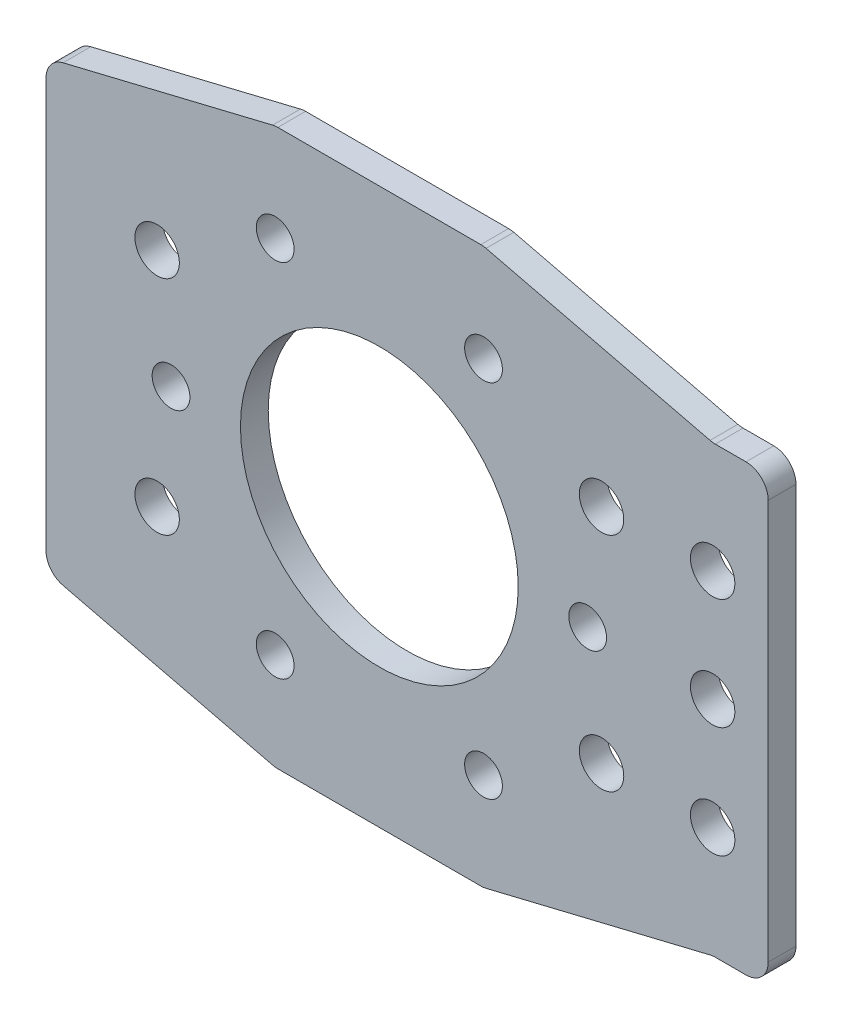
from build123d import *

# Parameters (mm, degrees)
SKETCH2_R           = 15.875
SKETCH2_R_2         = 2.159
SKETCH2_R_3         = 2.54
BOSS_EXTRUDE1_DEPTH = 3.175
FILLET1_R           = 2.54
SKETCH3_OUTSIDE_W   = 172.398
SKETCH3_OUTSIDE_H   = 96.198
SKETCH3_OUTSIDE_W_2 = 82.55
SKETCH3_OUTSIDE_H_2 = 74.066797773
CUT_EXTRUDE1_DEPTH  = 510.001122911
FILLET2_R           = 2.54


with BuildPart() as part:
    # Sketch2 → Boss-Extrude1 (new body)
    with BuildSketch(Plane.XY):
        Polygon((-508, 25.4), (-481.80625, 31.75), (-457.99375, 31.75), (-431.8, 25.4), (-368.3, 25.4), (-368.3, -25.4), (-431.8, -25.4), (-457.99375, -31.75), (-481.80625, -31.75), (-508, -25.4), align=None)
        with Locations((-469.9, 0)):
            Circle(SKETCH2_R, mode=Mode.SUBTRACT)
        with Locations((-457.99375, 20.622229928)):
            Circle(SKETCH2_R_2, mode=Mode.SUBTRACT)
        with Locations((-481.80625, 20.622229928)):
            Circle(SKETCH2_R_2, mode=Mode.SUBTRACT)
        with Locations((-493.7125, 0)):
            Circle(SKETCH2_R_2, mode=Mode.SUBTRACT)
        with Locations((-481.80625, -20.622229928)):
            Circle(SKETCH2_R_2, mode=Mode.SUBTRACT)
        with Locations((-457.99375, -20.622229928)):
            Circle(SKETCH2_R_2, mode=Mode.SUBTRACT)
        with Locations((-446.0875, 0)):
            Circle(SKETCH2_R_2, mode=Mode.SUBTRACT)
        with Locations((-495.3, 12.7)):
            Circle(SKETCH2_R_3, mode=Mode.SUBTRACT)
        with Locations((-495.3, -12.7)):
            Circle(SKETCH2_R_3, mode=Mode.SUBTRACT)
        with Locations((-444.5, -12.7)):
            Circle(SKETCH2_R_3, mode=Mode.SUBTRACT)
        with Locations((-431.8, -12.7)):
            Circle(SKETCH2_R_3, mode=Mode.SUBTRACT)
        with Locations((-419.1, -12.7)):
            Circle(SKETCH2_R_3, mode=Mode.SUBTRACT)
        with Locations((-419.1, 0)):
            Circle(SKETCH2_R_3, mode=Mode.SUBTRACT)
        with Locations((-431.8, 0)):
            Circle(SKETCH2_R_3, mode=Mode.SUBTRACT)
        with Locations((-431.8, 12.7)):
            Circle(SKETCH2_R_3, mode=Mode.SUBTRACT)
        with Locations((-419.1, 12.7)):
            Circle(SKETCH2_R_3, mode=Mode.SUBTRACT)
        with Locations((-444.5, 12.7)):
            Circle(SKETCH2_R_3, mode=Mode.SUBTRACT)
        with Locations((-406.4, 12.7)):
            Circle(SKETCH2_R_3, mode=Mode.SUBTRACT)
        with Locations((-406.4, 0)):
            Circle(SKETCH2_R_3, mode=Mode.SUBTRACT)
        with Locations((-406.4, -12.7)):
            Circle(SKETCH2_R_3, mode=Mode.SUBTRACT)
        with Locations((-393.7, 12.7)):
            Circle(SKETCH2_R_3, mode=Mode.SUBTRACT)
        with Locations((-393.7, 0)):
            Circle(SKETCH2_R_3, mode=Mode.SUBTRACT)
        with Locations((-393.7, -12.7)):
            Circle(SKETCH2_R_3, mode=Mode.SUBTRACT)
        with Locations((-381, 12.7)):
            Circle(SKETCH2_R_3, mode=Mode.SUBTRACT)
        with Locations((-381, 0)):
            Circle(SKETCH2_R_3, mode=Mode.SUBTRACT)
        with Locations((-381, -12.7)):
            Circle(SKETCH2_R_3, mode=Mode.SUBTRACT)
    extrude(amount=BOSS_EXTRUDE1_DEPTH)

    # Fillet1
    fillet1_edges = [part.edges().sort_by_distance(p)[0] for p in [
        (-508, 25.4, 1.5875),
        (-481.80625, 31.75, 1.5875),
        (-457.99375, 31.75, 1.5875),
        (-431.8, 25.4, 1.5875),
        (-368.3, 25.4, 1.5875),
        (-368.3, -25.4, 1.5875),
        (-431.8, -25.4, 1.5875),
        (-457.99375, -31.75, 1.5875),
        (-481.80625, -31.75, 1.5875),
        (-508, -25.4, 1.5875),
    ]]
    fillet(fillet1_edges, radius=FILLET1_R)

    # Sketch3 outside → Cut-Extrude1 (cut, through all)
    with BuildSketch(Plane.XY.offset(3.175)):
        with Locations((-438.15, 0)):
            Rectangle(SKETCH3_OUTSIDE_W, SKETCH3_OUTSIDE_H)
        with Locations((-466.725, 2.505642685)):
            Rectangle(SKETCH3_OUTSIDE_W_2, SKETCH3_OUTSIDE_H_2, mode=Mode.SUBTRACT)
    extrude(amount=-CUT_EXTRUDE1_DEPTH, mode=Mode.SUBTRACT)

    # Fillet2
    fillet2_edges = [part.edges().sort_by_distance(p)[0] for p in [
        (-425.45, 25.4, 1.5875),
        (-425.45, -25.4, 1.5875),
    ]]
    fillet(fillet2_edges, radius=FILLET2_R)


solid = part.part
